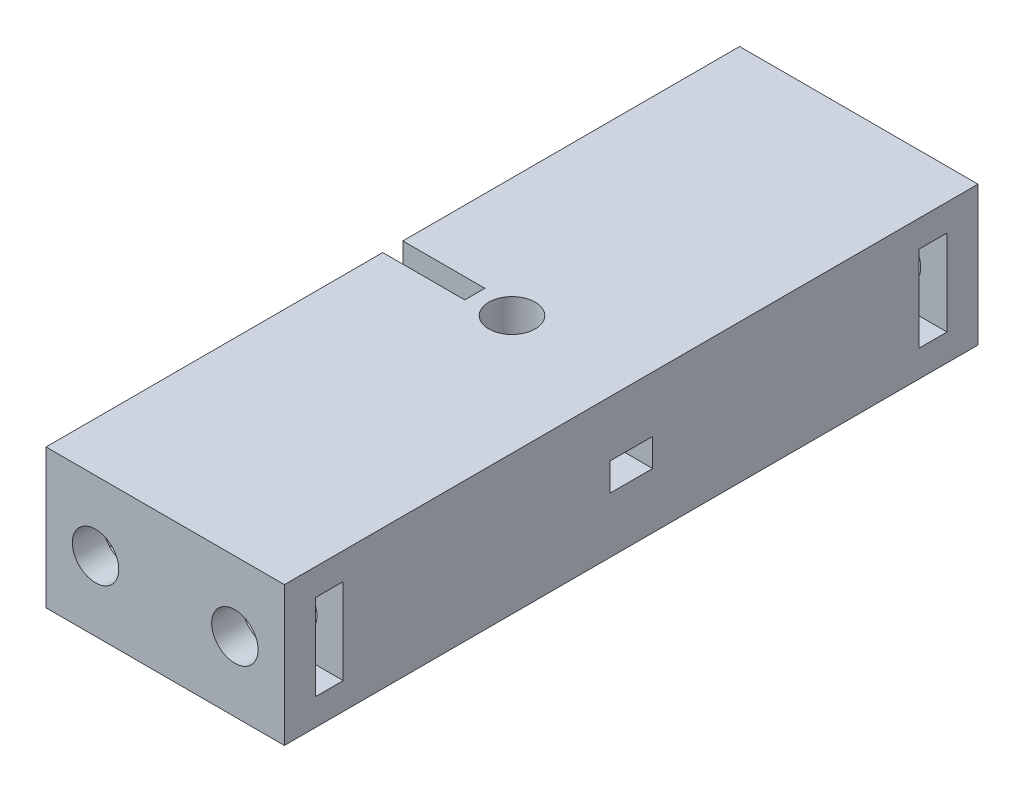
from build123d import *

# Parameters (mm, degrees)
SKETCH1_W               = 15.4
SKETCH1_H               = 9
SKETCH1_R               = 1.5
BOSS_EXTRUDE1_DEPTH     = 44.8
CUT_EXTRUDE1_DEPTH      = 1.8
SKETCH3_R               = 1.5
CUT_EXTRUDE2_DEPTH      = 49.220327664
CUT_EXTRUDE3_DEPTH      = 1.8
SKETCH6_W               = 5.542562584
SKETCH6_H               = 1.8
CUT_EXTRUDE4_DEPTH      = 7.7
CUT_EXTRUDE5_REACH      = 50.22
SKETCH7_W               = 5.3
SKETCH7_H               = 1.3
SKETCH8_W               = 2.771281292
SKETCH8_H               = 1.8
CUT_EXTRUDE6_DEPTH      = 47.797970041
SKETCH10_W              = 1.8
SKETCH10_H              = 5.542562584
CUT_EXTRUDE7_DEPTH      = 3.2
SKETCH11_W              = 1.8
SKETCH11_H              = 2.771281292
CUT_EXTRUDE8_DEPTH      = 47.734141695
MIRROR3_COPY_1_SKETCH_W = 1.8
MIRROR3_COPY_1_SKETCH_H = 5.542562584
MIRROR3_COPY_1_DEPTH    = 3.2


with BuildPart() as part:
    # Sketch1 → Boss-Extrude1 (new body)
    with BuildSketch(Plane.XY):
        with Locations((7.7, 4.5)):
            Rectangle(SKETCH1_W, SKETCH1_H)
        with Locations((3.2, 4.5)):
            Circle(SKETCH1_R, mode=Mode.SUBTRACT)
        with Locations((12.2, 4.5)):
            Circle(SKETCH1_R, mode=Mode.SUBTRACT)
    extrude(amount=BOSS_EXTRUDE1_DEPTH)

    # Sketch2 → Cut-Extrude1 (cut)
    with BuildSketch(Plane(origin=(0, 0, 2), x_dir=(-1, 0, 0), z_dir=(0, 0, -1))):
        Polygon((-0.8, 3.114359354), (-3.2, 1.728718708), (-5.6, 3.114359354), (-5.6, 5.885640646), (-3.2, 7.271281292), (-0.8, 5.885640646), align=None)
        Polygon((-12.2, 1.728718708), (-9.8, 3.114359354), (-9.8, 5.885640646), (-12.2, 7.271281292), (-14.6, 5.885640646), (-14.6, 3.114359354), align=None)
    cut_extrude1 = extrude(amount=-CUT_EXTRUDE1_DEPTH, mode=Mode.SUBTRACT)

    # Mirror1: Cut-Extrude1 across plane
    add(cut_extrude1.mirror(Plane(origin=(0, 0, 22.4), x_dir=(1, 0, 0), z_dir=(0, 0, -1))), mode=Mode.SUBTRACT)

    # Sketch3 → Cut-Extrude2 (cut, through all)
    with BuildSketch(Plane(origin=(0, 9, 0), x_dir=(1, 0, 0), z_dir=(0, 1, 0))):
        with Locations(Location((7.7, -22.4, 0), (0, 0, 270))):
            Circle(SKETCH3_R)
    extrude(amount=-CUT_EXTRUDE2_DEPTH, mode=Mode.SUBTRACT)

    # Sketch4 → Cut-Extrude3 (cut)
    with BuildSketch(Plane(origin=(0, 5.4, 0), x_dir=(1, 0, 0), z_dir=(0, 1, 0))):
        Polygon((7.7, -19.628718708), (5.3, -21.014359354), (5.3, -23.785640646), (7.7, -25.171281292), (10.1, -23.785640646), (10.1, -21.014359354), align=None)
    extrude(amount=-CUT_EXTRUDE3_DEPTH, mode=Mode.SUBTRACT)

    # Sketch6 → Cut-Extrude4 (cut)
    with BuildSketch(Plane.ZY):
        with Locations((22.4, 4.5)):
            Rectangle(SKETCH6_W, SKETCH6_H)
    extrude(amount=-CUT_EXTRUDE4_DEPTH, mode=Mode.SUBTRACT)

    # Sketch7 → Cut-Extrude5 (cut, up to next)
    with BuildSketch(Plane(origin=(0, 9, 0), x_dir=(1, 0, 0), z_dir=(0, 1, 0)), mode=Mode.PRIVATE) as cut_extrude5_sk1:
        with Locations((2.65, -22.4)):
            Rectangle(SKETCH7_W, SKETCH7_H)
    cut_extrude5_tool1 = extrude(cut_extrude5_sk1.sketch, amount=-CUT_EXTRUDE5_REACH, mode=Mode.PRIVATE) & part.part
    add(cut_extrude5_tool1.solids().sort_by_distance((2.65, 9, 22.4))[0], mode=Mode.SUBTRACT)

    # Sketch8 → Cut-Extrude6 (cut, through all)
    with BuildSketch(Plane.ZY.offset(-10.1)):
        with Locations((22.4, 4.5)):
            Rectangle(SKETCH8_W, SKETCH8_H)
    extrude(amount=-CUT_EXTRUDE6_DEPTH, mode=Mode.SUBTRACT)

    # Sketch10 → Cut-Extrude7 (cut)
    with BuildSketch(Plane(origin=(15.4, 0, 0), x_dir=(0, 0, -1), z_dir=(1, 0, 0))):
        with Locations((-2.9, 4.5)):
            Rectangle(SKETCH10_W, SKETCH10_H)
    cut_extrude7 = extrude(amount=-CUT_EXTRUDE7_DEPTH, mode=Mode.SUBTRACT)

    # Mirror2: Cut-Extrude7 across plane
    add(cut_extrude7.mirror(Plane(origin=(7.7, 0, 0), x_dir=(0, 0, 1), z_dir=(1, 0, 0))), mode=Mode.SUBTRACT)

    # Sketch11 → Cut-Extrude8 (cut, through all)
    with BuildSketch(Plane(origin=(9.8, 0, 0), x_dir=(0, 0, -1), z_dir=(1, 0, 0))):
        with Locations((-2.9, 4.5)):
            Rectangle(SKETCH11_W, SKETCH11_H)
    cut_extrude8 = extrude(amount=-CUT_EXTRUDE8_DEPTH, mode=Mode.SUBTRACT)

    # Mirror3: Cut-Extrude7, Cut-Extrude8 across plane
    add(cut_extrude7.mirror(Plane(origin=(0, 0, 22.4), x_dir=(1, 0, 0), z_dir=(0, 0, -1))), mode=Mode.SUBTRACT)
    add(cut_extrude8.mirror(Plane(origin=(0, 0, 22.4), x_dir=(1, 0, 0), z_dir=(0, 0, -1))), mode=Mode.SUBTRACT)

    # Mirror3 copy 1 sketch → Mirror3 copy 1 (cut)
    with BuildSketch(Plane(origin=(0, 0, 44.8), x_dir=(0, 0, 1), z_dir=(-1, 0, 0))):
        with Locations((-2.9, 4.5)):
            Rectangle(MIRROR3_COPY_1_SKETCH_W, MIRROR3_COPY_1_SKETCH_H)
    extrude(amount=-MIRROR3_COPY_1_DEPTH, mode=Mode.SUBTRACT)


solid = part.part
